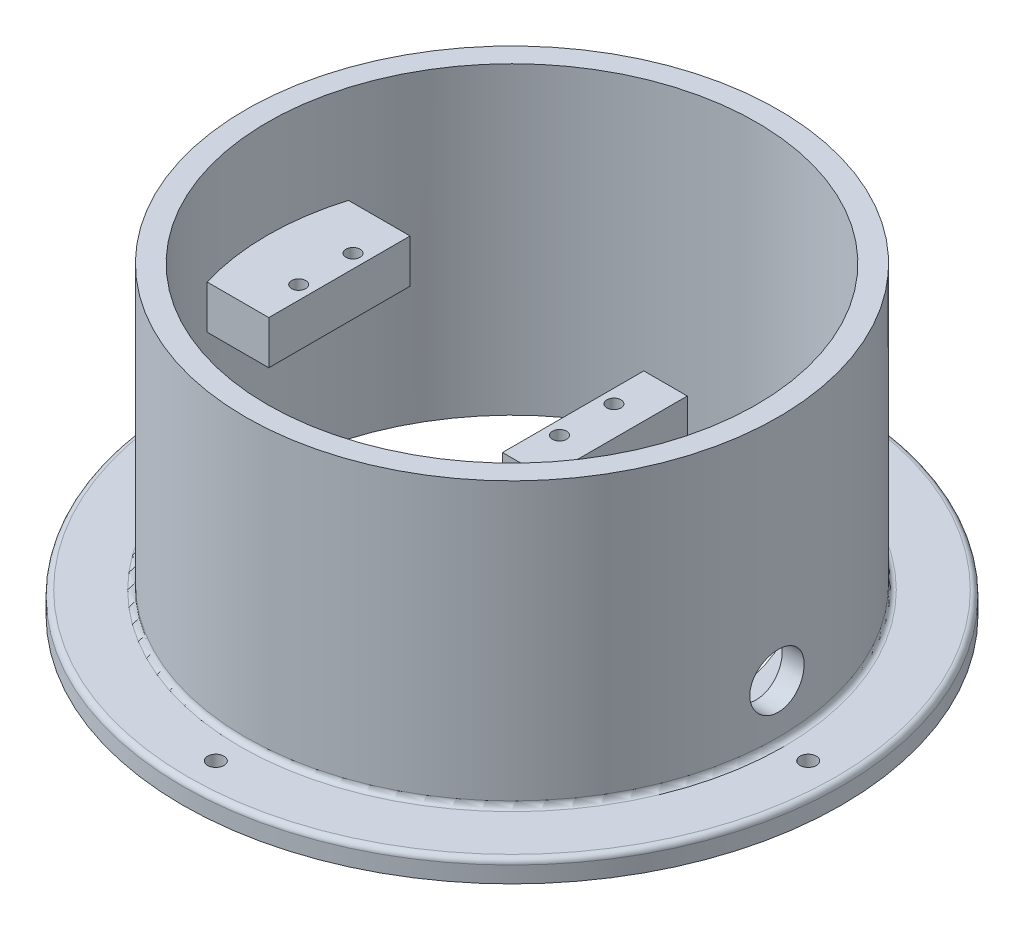
from build123d import *

# Parameters (mm, degrees)
SKETCH1_R           = 60.625
SKETCH1_R_2         = 45
BOSS_EXTRUDE1_DEPTH = 4
SKETCH2_R           = 49
SKETCH2_R_2         = 45
BOSS_EXTRUDE2_DEPTH = 52
SKETCH3_W           = 8
SKETCH3_H           = 38
SKETCH3_W_2         = 15
SKETCH3_H_2         = 8
BOSS_EXTRUDE3_DEPTH = 13
SKETCH4_W           = 10
SKETCH4_H           = 24
CUT_EXTRUDE1_DEPTH  = 8
SKETCH5_R           = 5
CUT_EXTRUDE2_DEPTH  = 110.441337026
SKETCH6_R           = 1.3
CUT_EXTRUDE3_DEPTH  = 7.2
BOSS_EXTRUDE4_DEPTH = 4
SKETCH8_R           = 1.5
CUT_EXTRUDE4_DEPTH  = 103.404986506
FILLET1_R           = 1


with BuildPart() as part:
    # Sketch1 → Boss-Extrude1 (new body)
    with BuildSketch(Plane(origin=(0, 0, 0), x_dir=(1, 0, 0), z_dir=(0, 1, 0))):
        with Locations(Location((0, 0, 0), (0, 0, 270))):
            Circle(SKETCH1_R)
        with Locations(Location((0, 0, 0), (0, 0, 270))):
            Circle(SKETCH1_R_2, mode=Mode.SUBTRACT)
    extrude(amount=BOSS_EXTRUDE1_DEPTH)

    # Sketch2 → Boss-Extrude2 (add)
    with BuildSketch(Plane(origin=(0, 4, 0), x_dir=(1, 0, 0), z_dir=(0, 1, 0))):
        with Locations(Location((0, 0, 0), (0, 0, 90))):
            Circle(SKETCH2_R)
        with Locations(Location((0, 0, 0), (0, 0, 270))):
            Circle(SKETCH2_R_2, mode=Mode.SUBTRACT)
    extrude(amount=BOSS_EXTRUDE2_DEPTH)

    # Sketch3 → Boss-Extrude3 (add, symmetric)
    with BuildSketch(Plane.XY):
        with Locations((15.25, 19)):
            Rectangle(SKETCH3_W, SKETCH3_H)
        with Locations((-39.25, 34)):
            Rectangle(SKETCH3_W_2, SKETCH3_H_2)
    extrude(amount=BOSS_EXTRUDE3_DEPTH, both=True)


with BuildPart() as boss_extrude3_piece_1:
    # of the separate pieces the step leaves, piece 1, a body of its own (boss_extrude3_pieces)
    add(part.part.solids().sort_by_distance((0, 0, 60.625))[0])

    # Sketch5 → Cut-Extrude2 (cut, through all)
    with BuildSketch(Plane.ZY.offset(-11.25)):
        with Locations((0, 14)):
            Circle(SKETCH5_R)
    extrude(amount=-CUT_EXTRUDE2_DEPTH, mode=Mode.SUBTRACT)


with BuildPart() as boss_extrude3_piece_2:
    # of the separate pieces the step leaves, piece 2, a body of its own (boss_extrude3_pieces)
    add(part.part.solids().sort_by_distance((11.25, 0, -13))[0])

    # Sketch4 → Cut-Extrude1 (cut)
    with BuildSketch(Plane.ZY.offset(-11.25)):
        with Locations((0, 17)):
            Rectangle(SKETCH4_W, SKETCH4_H)
    extrude(amount=-CUT_EXTRUDE1_DEPTH, mode=Mode.SUBTRACT)


with BuildPart() as cut_extrude3_tool:
    # Sketch6 → Cut-Extrude3 (new body)
    with BuildSketch(Plane(origin=(0, 38, 0), x_dir=(1, 0, 0), z_dir=(0, 1, 0))):
        with Locations(Location((-34.25, 5, 0), (0, 0, 270))):
            Circle(SKETCH6_R)
        with Locations(Location((-34.25, -5, 0), (0, 0, 270))):
            Circle(SKETCH6_R)
        with Locations(Location((13.75, 5, 0), (0, 0, 270))):
            Circle(SKETCH6_R)
        with Locations(Location((13.75, -5, 0), (0, 0, 270))):
            Circle(SKETCH6_R)
    extrude(amount=-CUT_EXTRUDE3_DEPTH)


with BuildPart() as boss_extrude3_piece_1_1:
    add(boss_extrude3_piece_1.part)

    # Cut-Extrude3: cut by cut_extrude3_tool
    add(cut_extrude3_tool.part, mode=Mode.SUBTRACT)



with BuildPart() as boss_extrude3_piece_2_1:
    add(boss_extrude3_piece_2.part)

    # Cut-Extrude3: cut by cut_extrude3_tool
    add(cut_extrude3_tool.part, mode=Mode.SUBTRACT)


with BuildPart() as boss_extrude3_piece_1_2:
    add(boss_extrude3_piece_1_1.part)

    add(boss_extrude3_piece_2_1.part)  # Boss-Extrude4 merges Boss-Extrude3 piece 2
    # Sketch7 → Boss-Extrude4 (add)
    with BuildSketch(Plane.XZ):
        with BuildLine():
            Line((11.25, -13), (25.249838503, -37.248431585))
            ThreePointArc((25.249838503, -37.248431585), (45, 0), (25.249838503, 37.248431585))
            Line((25.249838503, 37.248431585), (11.25, 13))
            Line((11.25, 13), (19.25, 13))
            Line((19.25, 13), (19.25, -13))
            Line((19.25, -13), (11.25, -13))
        make_face()
        with BuildLine():
            ThreePointArc((27.361802413, -24.906460381), (37, 0), (27.361802413, 24.906460381))
            Line((27.361802413, 24.906460381), (24.25, 19.516660498))
            Line((24.25, 19.516660498), (24.25, -19.516660498))
            Line((24.25, -19.516660498), (27.361802413, -24.906460381))
        make_face(mode=Mode.SUBTRACT)
    extrude(amount=-BOSS_EXTRUDE4_DEPTH)

    # Sketch8 → Cut-Extrude4 (cut, through all)
    with BuildSketch(Plane.XZ):
        with Locations(Location((54.5, 0, 0), (0, 0, 270))):
            Circle(SKETCH8_R)
        with Locations(Location((0, -54.5, 0), (0, 0, 270))):
            Circle(SKETCH8_R)
        with Locations(Location((-54.5, 0, 0), (0, 0, 270))):
            Circle(SKETCH8_R)
        with Locations(Location((0, 54.5, 0), (0, 0, 270))):
            Circle(SKETCH8_R)
    extrude(amount=-CUT_EXTRUDE4_DEPTH, mode=Mode.SUBTRACT)

    # Fillet1
    fillet1_edges = [boss_extrude3_piece_1_2.edges().sort_by_distance(p)[0] for p in [
        (0, 4, -60.625),
        (0, 4, 49),
    ]]
    fillet(fillet1_edges, radius=FILLET1_R)


solid = boss_extrude3_piece_1_2.part
